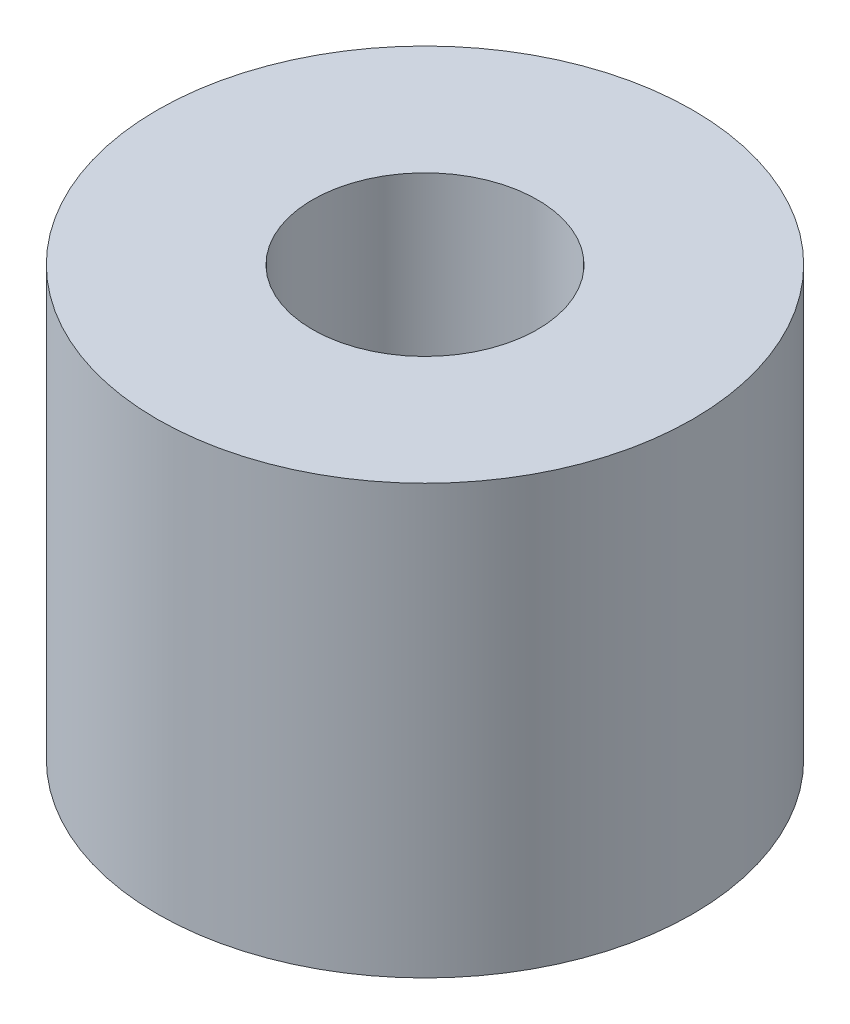
from build123d import *

# Parameters (mm, degrees)
SKETCH1_R           = 5
SKETCH1_R_2         = 2.1
BOSS_EXTRUDE1_DEPTH = 8


with BuildPart() as part:
    # Sketch1 → Boss-Extrude1 (new body)
    with BuildSketch(Plane(origin=(0, 0, 0), x_dir=(1, 0, 0), z_dir=(0, 1, 0))):
        with Locations(Location((0, 0, 0), (0, 0, 270))):
            Circle(SKETCH1_R)
        with Locations(Location((0, 0, 0), (0, 0, 270))):
            Circle(SKETCH1_R_2, mode=Mode.SUBTRACT)
    extrude(amount=BOSS_EXTRUDE1_DEPTH)


solid = part.part
